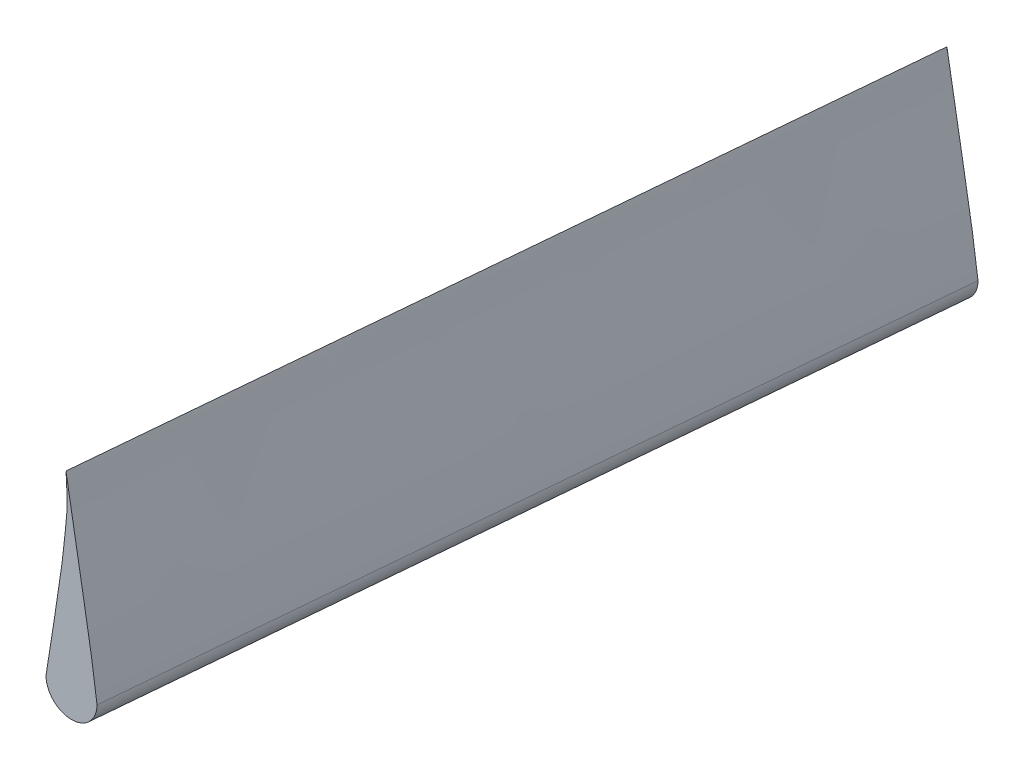
from build123d import *


with BuildPart() as part:
    # Sweep1: sweep along a curve in space
    with BuildLine() as sweep1_path:
        Line((108.163111705, 1062.25747855, 0), (110.607025705, 1283.618451727, 2641.600000004))
    # Sketch1 → Sweep1 (sweep)
    with BuildSketch(Plane.XY):
        with BuildLine():
            ThreePointArc((-44.642017633, 1062.25747855), (31.760547036, 985.854913881), (108.163111705, 1062.25747855))
            add(Edge.make_bspline(
                [(108.163111705, 1062.25747855), (107.796490349, 1065.209052156), (104.514218779, 1091.322780341), (97.692298325, 1140.538915039), (86.890046562, 1209.815528973), (75.138452034, 1278.867127596), (62.837744811, 1348.124497521), (50.614548031, 1416.018546665), (37.938844965, 1488.407110091), (28.105743252, 1543.568613207), (11.261413789, 1662.857583308), (21.477226024, 1543.134073321), (14.91629128, 1487.323757923), (8.692552052, 1415.126649018), (-0.773079201, 1347.296310002), (-10.53253288, 1278.324684445), (-21.563075596, 1209.503754801), (-32.473155121, 1141.115066576), (-40.142742372, 1092.050309752), (-44.113865395, 1065.769993486), (-44.642017633, 1062.25747855)],
                knots=[0.799626776, 0.799626776, 0.799626776, 0.799626776, 0.802790067, 0.827618886, 0.852471991, 0.87733719, 0.902189617, 0.927001991, 0.951757738, 0.976444336, 1.001125398, 1.02571177, 1.050269874, 1.074861649, 1.099031694, 1.124083857, 1.148678336, 1.173230205, 1.197720821, 1.201498622, 1.201498622, 1.201498622, 1.201498622], degree=3))
        make_face()
    sweep(path=sweep1_path.line)


solid = part.part
